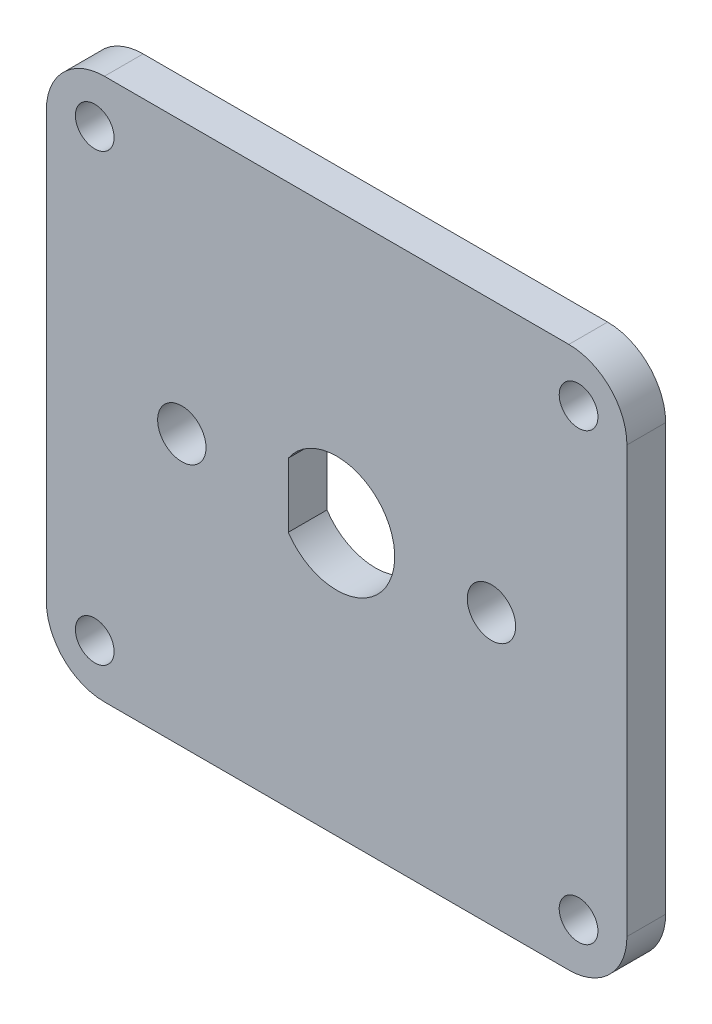
from build123d import *

# Parameters (mm, degrees)
SKETCH_1_W          = 30
SKETCH_1_H          = 28
EXTRUDE_1_DEPTH     = 2
FILLET_1_R          = 3
SKETCH_2_R          = 1
SKETCH_2_R_2        = 1.25
CUT_EXTRUDE_1_DEPTH = 10
SKETCH_3_R          = 3
CUT_EXTRUDE_2_DEPTH = 10
EXTRUDE_2_DEPTH     = 2


with BuildPart() as part:
    # 草图1 → 凸台-拉伸1 (new body)
    with BuildSketch(Plane.XY):
        Rectangle(SKETCH_1_W, SKETCH_1_H)
    extrude(amount=EXTRUDE_1_DEPTH)

    # 圆角1
    fillet_1_edges = [part.edges().sort_by_distance(p)[0] for p in [
        (-15, -14, 1),
        (-15, 14, 1),
        (15, 14, 1),
        (15, -14, 1),
    ]]
    fillet(fillet_1_edges, radius=FILLET_1_R)

    # 草图2 → 切除-拉伸1 (cut)
    with BuildSketch(Plane.XY.offset(2)):
        with Locations((-12.5, 11.5)):
            Circle(SKETCH_2_R)
        with Locations((12.5, 11.5)):
            Circle(SKETCH_2_R)
        with Locations((-12.5, -11.5)):
            Circle(SKETCH_2_R)
        with Locations((12.5, -11.5)):
            Circle(SKETCH_2_R)
        with Locations((8, 0)):
            Circle(SKETCH_2_R_2)
        with Locations((-8, 0)):
            Circle(SKETCH_2_R_2)
    extrude(amount=-CUT_EXTRUDE_1_DEPTH, mode=Mode.SUBTRACT)

    # 草图3 → 切除-拉伸2 (cut)
    with BuildSketch(Plane.XY.offset(2)):
        Circle(SKETCH_3_R)
    extrude(amount=-CUT_EXTRUDE_2_DEPTH, mode=Mode.SUBTRACT)

    # 草图4 → 凸台-拉伸2 (add)
    with BuildSketch(Plane.XY.offset(2)):
        with BuildLine():
            Line((-2.5, 1.658312395), (-2.5, -1.658312395))
            ThreePointArc((-2.5, -1.658312395), (-3, 0), (-2.5, 1.658312395))
        make_face()
    extrude(amount=-EXTRUDE_2_DEPTH)


solid = part.part
